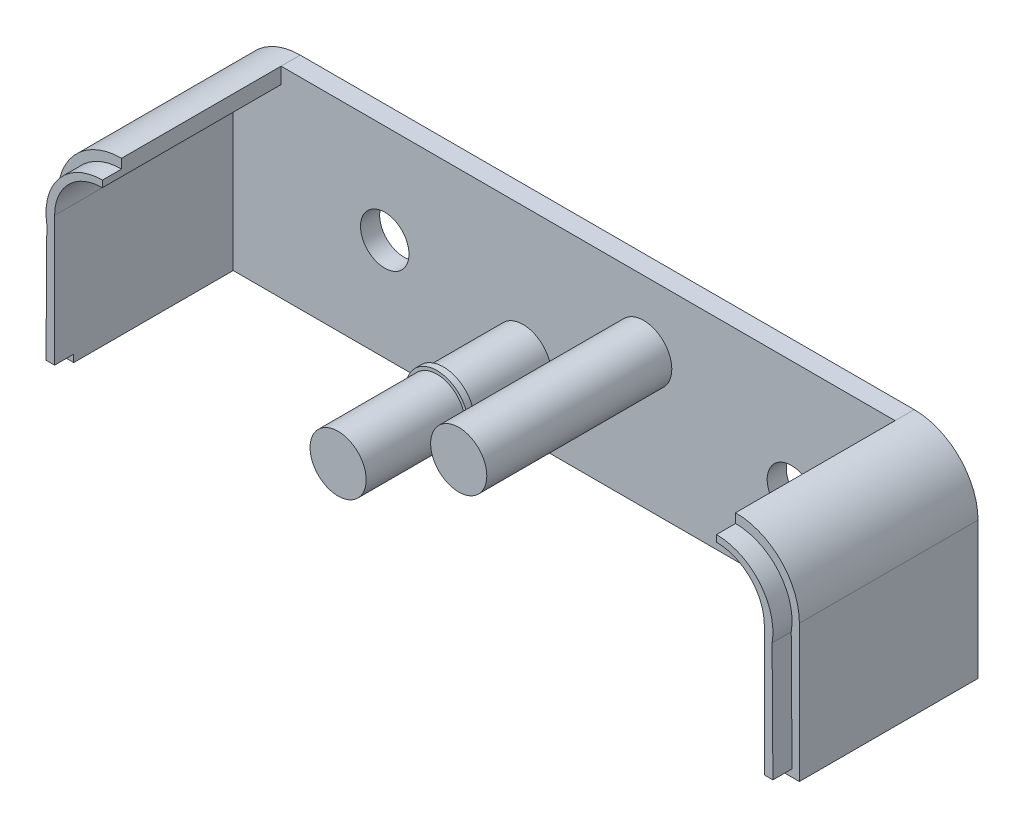
from build123d import *

# Parameters (mm, degrees)
SKETCH1_R           = 3.8
BOSS_EXTRUDE2_DEPTH = 3
SKETCH2_R           = 4.4
BOSS_EXTRUDE3_DEPTH = 25
CUT_EXTRUDE3_START  = -1
SKETCH10_R          = 4.4
CUT_EXTRUDE3_DEPTH  = 1
BOSS_EXTRUDE5_DEPTH = 3
SKETCH12_R          = 4.4
BOSS_EXTRUDE6_DEPTH = 5
SKETCH14_R          = 4.9
BOSS_EXTRUDE7_DEPTH = 1


with BuildPart() as part:
    # Sketch1 → Boss-Extrude2 (new body)
    with BuildSketch(Plane.XY):
        with BuildLine():
            Line((-48.125, 15.75), (48.125, 15.75))
            ThreePointArc((48.125, 15.75), (55.196067812, 12.821067812), (58.125, 5.75))
            Line((58.125, 5.75), (58.125, -15.75))
            Line((58.125, -15.75), (-58.125, -15.75))
            Line((-58.125, -15.75), (-58.125, 5.75))
            ThreePointArc((-58.125, 5.75), (-55.196067812, 12.821067812), (-48.125, 15.75))
        make_face()
        with Locations((31.875, -2.25)):
            Circle(SKETCH1_R, mode=Mode.SUBTRACT)
        with Locations((-31.875, 0.25)):
            Circle(SKETCH1_R, mode=Mode.SUBTRACT)
    extrude(amount=BOSS_EXTRUDE2_DEPTH)

    # Sketch2 → Boss-Extrude3 (add)
    with BuildSketch(Plane.XY.offset(3)):
        with Locations((8.725, 5.25)):
            Circle(SKETCH2_R)
        with Locations((-10.185, -4.75)):
            Circle(SKETCH2_R)
        with BuildLine():
            Line((55.625, 5.75), (55.625, -15.75))
            Line((55.625, -15.75), (58.125, -15.75))
            Line((58.125, -15.75), (58.125, 5.25))
            Line((58.125, 5.25), (58.125, 5.75))
            ThreePointArc((58.125, 5.75), (55.196067812, 12.821067812), (48.125, 15.75))
            Line((48.125, 15.75), (48.125, 13.25))
            ThreePointArc((48.125, 13.25), (53.428300859, 11.053300859), (55.625, 5.75))
        make_face()
        with BuildLine():
            Line((-58.125, -15.75), (-55.625, -15.75))
            Line((-55.625, -15.75), (-55.625, 5.75))
            ThreePointArc((-55.625, 5.75), (-53.428300859, 11.053300859), (-48.125, 13.25))
            Line((-48.125, 13.25), (-48.125, 15.75))
            ThreePointArc((-48.125, 15.75), (-55.196067812, 12.821067812), (-58.125, 5.75))
            Line((-58.125, 5.75), (-58.125, 5.25))
            Line((-58.125, 5.25), (-58.125, -15.75))
        make_face()
    extrude(amount=BOSS_EXTRUDE3_DEPTH)

    # Sketch10 → Cut-Extrude3 (cut)
    with BuildSketch(Plane.XY.offset(28).offset(CUT_EXTRUDE3_START)):
        with Locations((8.725, 5.25)):
            Circle(SKETCH10_R)
        with Locations((-10.185, -4.75)):
            Circle(SKETCH10_R)
    extrude(amount=CUT_EXTRUDE3_DEPTH, mode=Mode.SUBTRACT)

    # Sketch5 → Boss-Extrude5 (add)
    with BuildSketch(Plane.XY.offset(28)):
        with BuildLine():
            Line((-56.84687889, 3.934747007), (-56.975, -14.6))
            Line((-56.975, -14.6), (-55.625, -14.6))
            Line((-55.625, -14.6), (-55.625, 5.75))
            ThreePointArc((-55.625, 5.75), (-53.428300859, 11.053300859), (-48.125, 13.25))
            Line((-48.125, 13.25), (-48.125, 14.285189819))
            ThreePointArc((-48.125, 14.285189819), (-54.892622141, 11.137977782), (-56.84687889, 3.934747007))
        make_face()
        with BuildLine():
            Line((55.625, -14.6), (55.625, 5.75))
            ThreePointArc((55.625, 5.75), (53.428300859, 11.053300859), (48.125, 13.25))
            Line((48.125, 13.25), (48.125, 14.285189819))
            ThreePointArc((48.125, 14.285189819), (54.892622141, 11.137977782), (56.84687889, 3.934747007))
            Line((56.84687889, 3.934747007), (56.975, -14.6))
            Line((56.975, -14.6), (55.625, -14.6))
        make_face()
    extrude(amount=BOSS_EXTRUDE5_DEPTH)

    # Sketch12 → Boss-Extrude6 (add)
    with BuildSketch(Plane.XY.offset(27)):
        with Locations((-10.185, -4.75)):
            Circle(SKETCH12_R)
        with Locations((8.725, 5.25)):
            Circle(SKETCH12_R)
    extrude(amount=BOSS_EXTRUDE6_DEPTH)

    # Sketch14 → Boss-Extrude7 (add)
    with BuildSketch(Plane.XY.offset(15.5)):
        with Locations((-10.185, -4.75)):
            Circle(SKETCH14_R)
    extrude(amount=BOSS_EXTRUDE7_DEPTH)


solid = part.part
